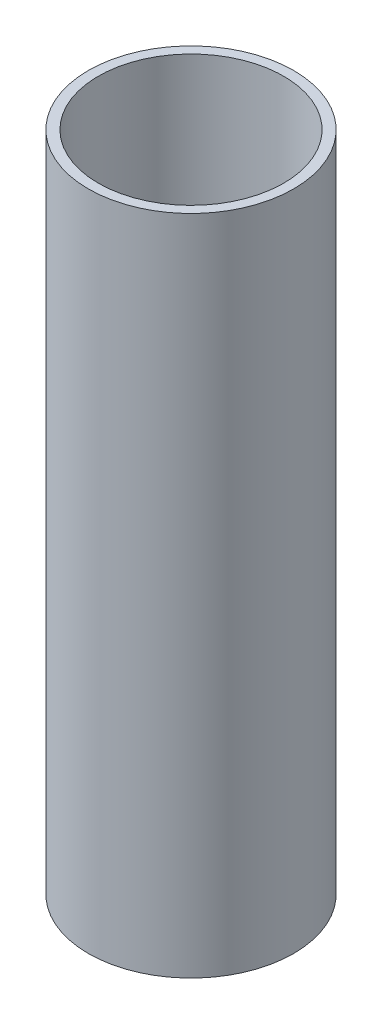
from build123d import *

# Parameters (mm, degrees)
SKETCH1_R           = 15.5
SKETCH1_R_2         = 14
BOSS_EXTRUDE1_DEPTH = 50


with BuildPart() as part:
    # Sketch1 → Boss-Extrude1 (new, symmetric)
    with BuildSketch(Plane(origin=(0, 0, 0), x_dir=(1, 0, 0), z_dir=(0, 1, 0))):
        with Locations(Location((0, 0, 0), (0, 0, 270))):
            Circle(SKETCH1_R)
        with Locations(Location((0, 0, 0), (0, 0, 270))):
            Circle(SKETCH1_R_2, mode=Mode.SUBTRACT)
    extrude(amount=BOSS_EXTRUDE1_DEPTH, both=True)


solid = part.part
